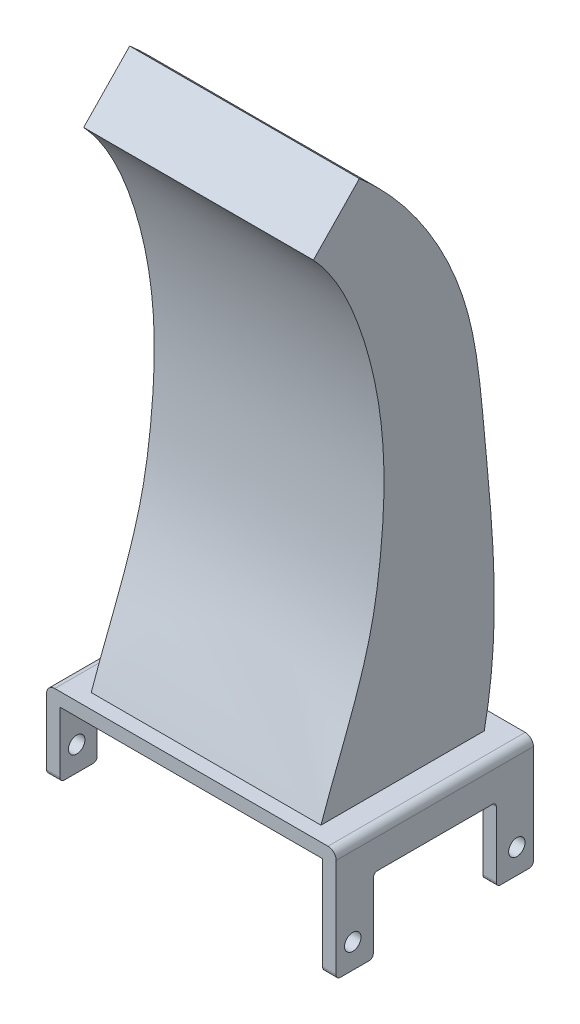
from build123d import *

# Parameters (mm, degrees)
SKETCH1_W                = 35.3
SKETCH1_H                = 24.04
BOSS_EXTRUDE1_DEPTH      = 1.65
SKETCH2_R                = 1
BOSS_EXTRUDE2_DEPTH      = 1.65
SKETCH3_R                = 1
BOSS_EXTRUDE3_DEPTH      = 1.65
FILLET1_R                = 1
FILLET2_R                = 1
FILLET3_R                = 0.5
BOSS_EXTRUDE4_DEPTH      = 14
BOSS_EXTRUDE4_DEPTH_BACK = 14


with BuildPart() as part:
    # Sketch1 → Boss-Extrude1 (new body)
    with BuildSketch(Plane(origin=(0, 0, 0), x_dir=(1, 0, 0), z_dir=(0, 1, 0))):
        Rectangle(SKETCH1_W, SKETCH1_H)
    extrude(amount=BOSS_EXTRUDE1_DEPTH)

    # Sketch2 → Boss-Extrude2 (add)
    # profile 1 of 2: a face of its own
    with BuildSketch(Plane(origin=(17.65, 0, 0), x_dir=(0, 0, -1), z_dir=(1, 0, 0))):
        Polygon((-7.5, -2.95), (0, -2.95), (0, 0), (-12.02, 0), (-12.02, -11.95), (-7.5, -11.95), align=None)
        with Locations((-10, -8.95)):
            Circle(SKETCH2_R, mode=Mode.SUBTRACT)
    # profile 2 of 2: a face of its own
    with BuildSketch(Plane(origin=(17.65, 0, 0), x_dir=(0, 0, -1), z_dir=(1, 0, 0))):
        Polygon((7.5, -2.95), (7.5, -11.95), (12.02, -11.95), (12.02, 0), (0, 0), (0, -2.95), align=None)
        with Locations((10, -8.95)):
            Circle(SKETCH2_R, mode=Mode.SUBTRACT)
    extrude(amount=-BOSS_EXTRUDE2_DEPTH)

    # Sketch3 → Boss-Extrude3 (add)
    # profile 1 of 2: a face of its own
    with BuildSketch(Plane.ZY.offset(17.65)):
        Polygon((-7.5, -2.95), (0, -2.95), (0, 0), (-12.02, 0), (-12.02, -7.95), (-7.5, -7.95), align=None)
        with Locations((-10, -4.95)):
            Circle(SKETCH3_R, mode=Mode.SUBTRACT)
    # profile 2 of 2: a face of its own
    with BuildSketch(Plane.ZY.offset(17.65)):
        Polygon((7.5, -2.95), (7.5, -7.95), (12.02, -7.95), (12.02, 0), (0, 0), (0, -2.95), align=None)
        with Locations((10, -4.95)):
            Circle(SKETCH3_R, mode=Mode.SUBTRACT)
    extrude(amount=-BOSS_EXTRUDE3_DEPTH)

    # Fillet1
    fillet1_edges = [part.edges().sort_by_distance(p)[0] for p in [
        (17.65, 1.65, 0),
    ]]
    fillet(fillet1_edges, radius=FILLET1_R)

    # Fillet2
    fillet2_edges = [part.edges().sort_by_distance(p)[0] for p in [
        (-17.65, 1.65, 0),
    ]]
    fillet(fillet2_edges, radius=FILLET2_R)

    # Fillet3
    fillet3_edges = [part.edges().sort_by_distance(p)[0] for p in [
        (16.825, -2.95, -7.5),
        (16.825, -2.95, 7.5),
        (16.825, -11.95, 7.5),
        (16.825, -11.95, 12.02),
        (16.825, -11.95, -12.02),
        (16.825, -11.95, -7.5),
        (-16.825, -2.95, 7.5),
        (-16.825, -2.95, -7.5),
        (-16.825, -7.95, -7.5),
        (-16.825, -7.95, -12.02),
        (-16.825, -7.95, 12.02),
        (-16.825, -7.95, 7.5),
    ]]
    fillet(fillet3_edges, radius=FILLET3_R)

    # Sketch4 → Boss-Extrude4 (add, two sides: drawn at the far end of the back side and taken through both)
    with BuildSketch(Plane(origin=(0, 0, 0), x_dir=(0, 0, -1), z_dir=(1, 0, 0)).offset(-BOSS_EXTRUDE4_DEPTH_BACK)):
        with BuildLine():
            Line((9.673745494, 1.65), (-10.226501203, 1.65))
            add(Edge.make_bspline(
                [(-10.226501203, 1.65), (-8.891224977, 5.530955374), (-6.375704163, 11.330046393), (-3.820665891, 19.806139444), (-2.764219946, 27.368362999), (-2.335750521, 35.535912297), (-3.203822549, 43.922996008), (-5.602089045, 52.956296901), (-8.540401229, 58.923289291), (-11.151435745, 61.762281392)],
                knots=[0, 0, 0, 0, 0.194993698, 0.300246292, 0.419626293, 0.557022386, 0.6882025, 0.818561674, 1, 1, 1, 1], degree=3))
            Line((-11.151435745, 61.762281392), (-5.544090215, 67.556340911))
            add(Edge.make_bspline(
                [(9.673745494, 1.65), (11.84947814, 12.11563518), (10.148937614, 27.194651819), (8.164850445, 50.667229732), (0.673420069, 62.180853152), (-5.544090215, 67.556340911)],
                knots=[0, 0, 0, 0, 0.450087838, 0.646462243, 1, 1, 1, 1], degree=3))
        make_face()
    extrude(amount=BOSS_EXTRUDE4_DEPTH + BOSS_EXTRUDE4_DEPTH_BACK)


solid = part.part
